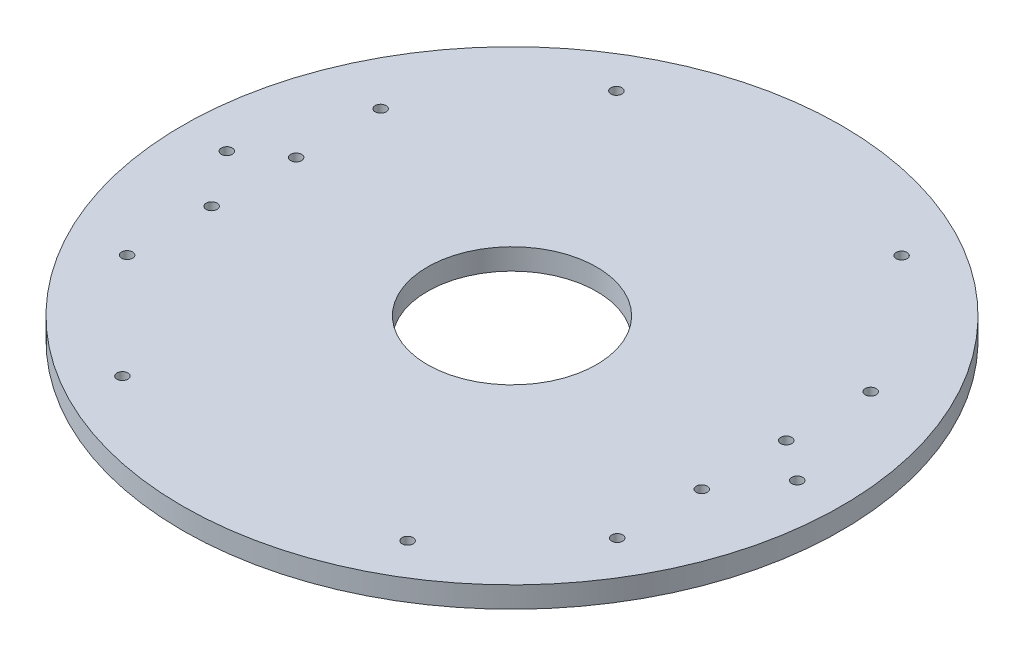
from build123d import *

# Parameters (mm, degrees)
SKETCH_1_R               = 156
EXTRUDE_1_DEPTH          = 10
SKETCH_2_R               = 2.6
CUT_EXTRUDE_1_DEPTH      = 221.843836228
SKETCH_3_R               = 40.05
CUT_EXTRUDE_2_DEPTH      = 10
SKETCH_4_R               = 2.6
CUT_EXTRUDE_4_DEPTH      = 221.843836228
PATTERN_CIRCULAR_1_COUNT = 6


with BuildPart() as part:
    # Эскиз1 → Бобышка-Вытянуть1 (new body)
    with BuildSketch(Plane(origin=(0, 0, 0), x_dir=(1, 0, 0), z_dir=(0, 1, 0))):
        with Locations(Location((0, 0, 0), (0, 0, 270))):
            Circle(SKETCH_1_R)
    extrude(amount=EXTRUDE_1_DEPTH)

    # Эскиз2 → Вырез-Вытянуть1 (cut, through all)
    with BuildSketch(Plane(origin=(0, 10, 0), x_dir=(1, 0, 0), z_dir=(0, 1, 0))):
        with Locations(Location((116, 13.8, 0), (0, 0, 270))):
            Circle(SKETCH_2_R)
        with Locations(Location((116, 53.8, 0), (0, 0, 270))):
            Circle(SKETCH_2_R)
        with Locations(Location((116, -26.2, 0), (0, 0, 270))):
            Circle(SKETCH_2_R)
        with Locations(Location((116, -66.2, 0), (0, 0, 270))):
            Circle(SKETCH_2_R)
        with Locations(Location((-116, -66.2, 0), (0, 0, 90))):
            Circle(SKETCH_2_R)
        with Locations(Location((-116, -26.2, 0), (0, 0, 90))):
            Circle(SKETCH_2_R)
        with Locations(Location((-116, 13.8, 0), (0, 0, 90))):
            Circle(SKETCH_2_R)
        with Locations(Location((-116, 53.8, 0), (0, 0, 90))):
            Circle(SKETCH_2_R)
    extrude(amount=-CUT_EXTRUDE_1_DEPTH, mode=Mode.SUBTRACT)

    # Эскиз3 → Вырез-Вытянуть2 (cut)
    with BuildSketch(Plane(origin=(0, 10, 0), x_dir=(1, 0, 0), z_dir=(0, 1, 0))):
        with Locations(Location((0, 0, 0), (0, 0, 270))):
            Circle(SKETCH_3_R)
    extrude(amount=-CUT_EXTRUDE_2_DEPTH, mode=Mode.SUBTRACT)

    # Эскиз4 → Вырез-Вытянуть4 (cut, through all)
    with BuildSketch(Plane(origin=(0, 10, 0), x_dir=(1, 0, 0), z_dir=(0, 1, 0))):
        with Locations(Location((-135, 0, 0), (0, 0, 270))):
            Circle(SKETCH_4_R)
    cut_extrude_4 = extrude(amount=-CUT_EXTRUDE_4_DEPTH, mode=Mode.SUBTRACT)

    # Круговой массив1: Вырез-Вытянуть4 ×6 about axis
    pattern_circular_1_axis = Axis((0, 0, 0), (0, 1, 0))
    for i in range(1, PATTERN_CIRCULAR_1_COUNT):
        add(cut_extrude_4.rotate(pattern_circular_1_axis, i * 360 / PATTERN_CIRCULAR_1_COUNT), mode=Mode.SUBTRACT)


solid = part.part
